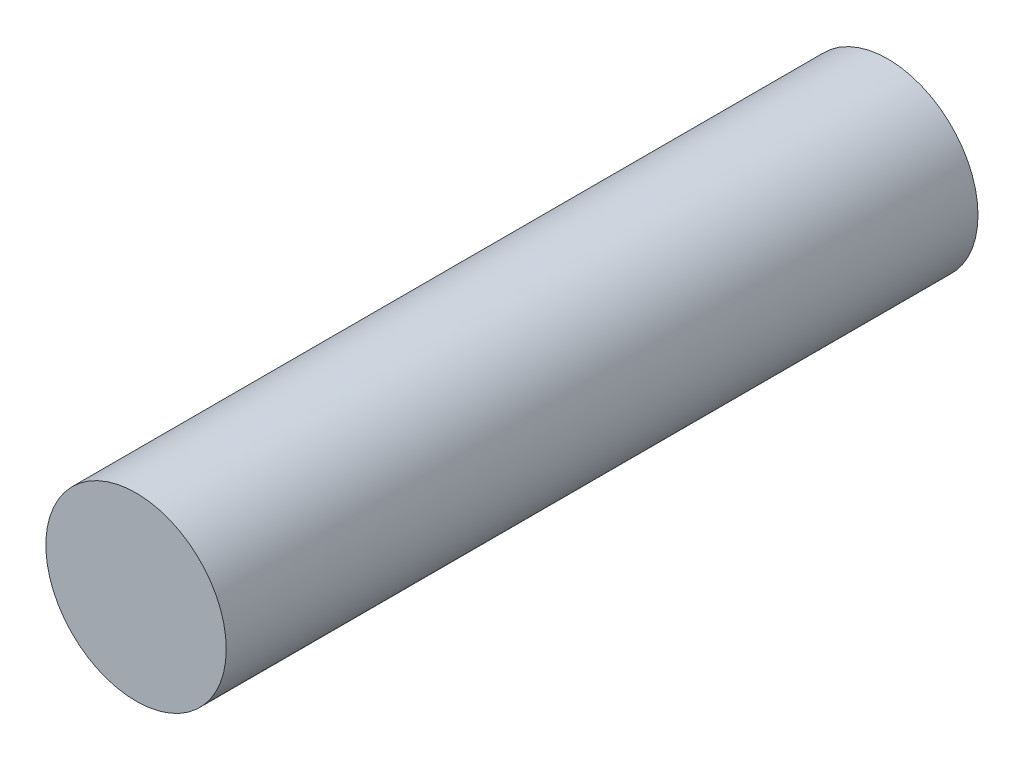
from build123d import *

# Parameters (mm, degrees)
SKETCH_1_R      = 6
EXTRUDE_1_DEPTH = 50


with BuildPart() as part:
    # 草图1 → 凸台-拉伸1 (new body)
    with BuildSketch(Plane.XY):
        Circle(SKETCH_1_R)
    extrude(amount=EXTRUDE_1_DEPTH)


solid = part.part
